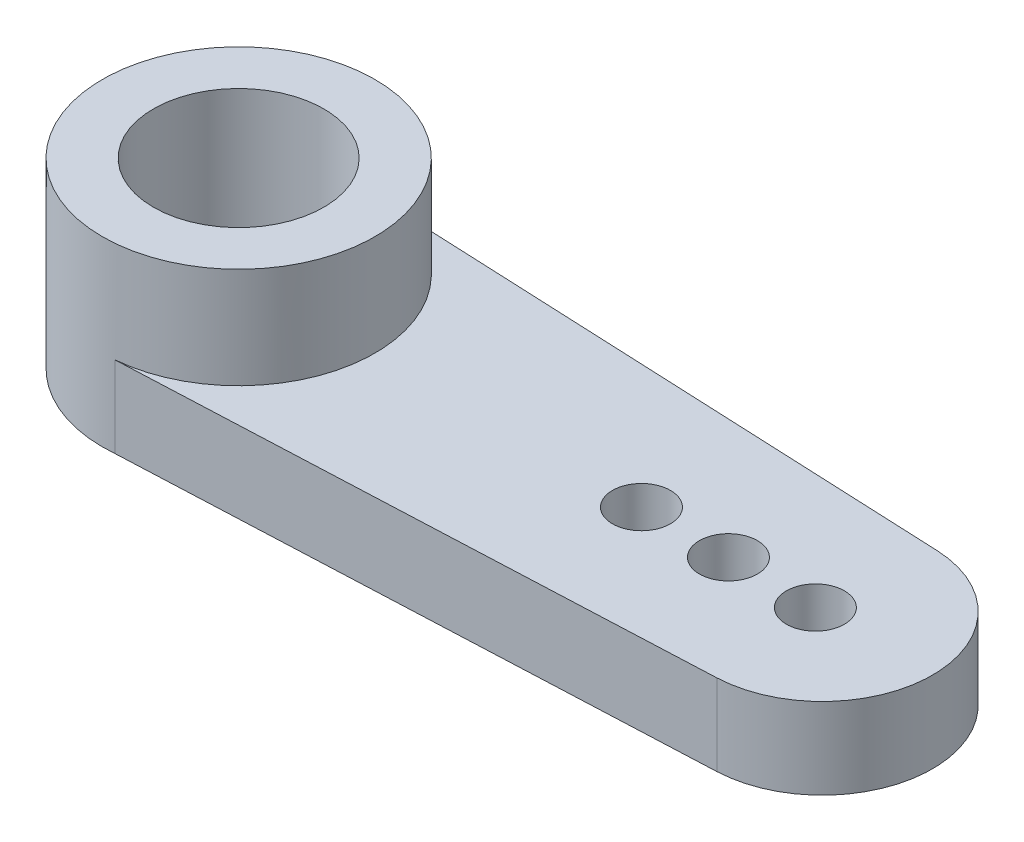
from build123d import *

# Parameters (mm, degrees)
SKETCH1_R           = 2.9845
SKETCH1_R_2         = 1.8669
BOSS_EXTRUDE1_DEPTH = 3.9878
BOSS_EXTRUDE2_DEPTH = 1.778
SKETCH3_R           = 0.635
CUT_EXTRUDE1_DEPTH  = 16.994250438


with BuildPart() as part:
    # Sketch1 → Boss-Extrude1 (new body)
    with BuildSketch(Plane(origin=(0, 0, 0), x_dir=(1, 0, 0), z_dir=(0, 1, 0))):
        with Locations(Location((0, 0, 0), (0, 0, 270))):
            Circle(SKETCH1_R)
        with Locations(Location((0, 0, 0), (0, 0, 270))):
            Circle(SKETCH1_R_2, mode=Mode.SUBTRACT)
    extrude(amount=BOSS_EXTRUDE1_DEPTH)

    # Sketch2 → Boss-Extrude2 (add)
    with BuildSketch(Plane.XZ):
        with BuildLine():
            Line((12.8905, 2.413), (0.264116324, 2.972790409))
            ThreePointArc((0.264116324, 2.972790409), (2.201760139, 2.01481824), (2.9845, 0))
            ThreePointArc((2.9845, 0), (2.201760139, -2.01481824), (0.264116324, -2.972790409))
            Line((0.264116324, -2.972790409), (12.8905, -2.413))
            ThreePointArc((12.8905, -2.413), (15.198890025, 0), (12.8905, 2.413))
        make_face()
    extrude(amount=-BOSS_EXTRUDE2_DEPTH)

    # Sketch3 → Cut-Extrude1 (cut, through all)
    with BuildSketch(Plane.XZ):
        with Locations(Location((8.823490025, 0, 0), (0, 0, 270))):
            Circle(SKETCH3_R)
        with Locations(Location((10.728490025, 0, 0), (0, 0, 270))):
            Circle(SKETCH3_R)
        with Locations(Location((12.633490025, 0, 0), (0, 0, 270))):
            Circle(SKETCH3_R)
    extrude(amount=-CUT_EXTRUDE1_DEPTH, mode=Mode.SUBTRACT)


solid = part.part
